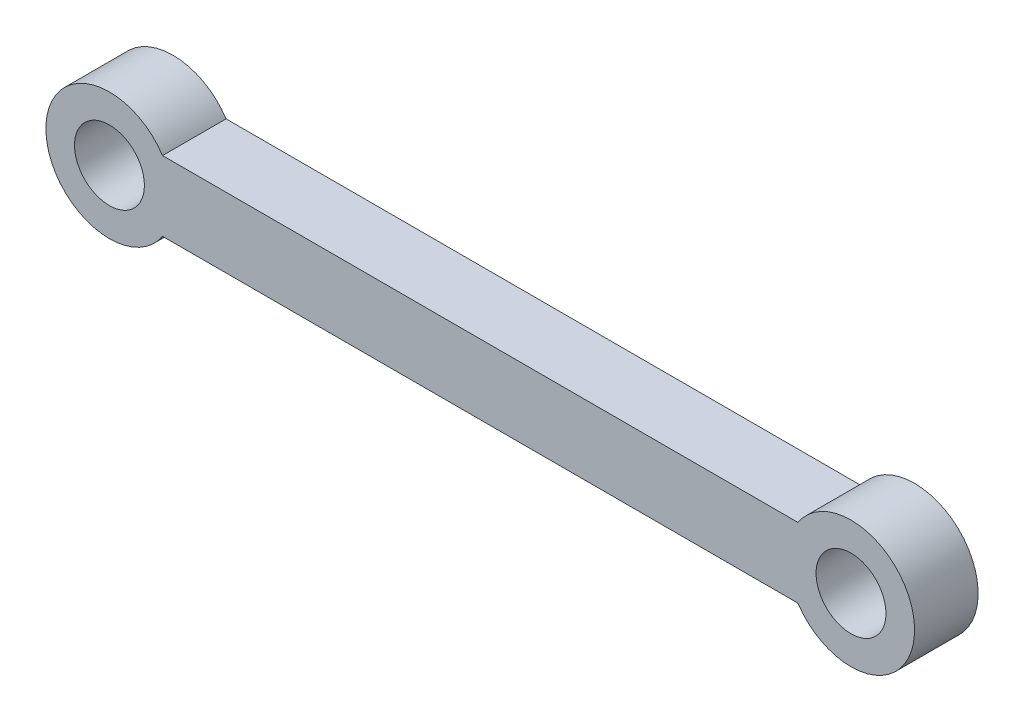
from build123d import *

# Parameters (mm, degrees)
EXTRUDE_1_DEPTH = 3


with BuildPart() as part:
    # 草图1 → 凸台-拉伸1 (new body)
    with BuildSketch(Plane.XY):
        with BuildLine():
            Line((32.494506037, 1.65), (2.505493963, 1.65))
            ThreePointArc((2.505493963, 1.65), (2.87371553, 0.86125435), (3, 0))
            ThreePointArc((3, 0), (2.87371553, -0.86125435), (2.505493963, -1.65))
            Line((2.505493963, -1.65), (32.494506037, -1.65))
            ThreePointArc((32.494506037, -1.65), (32, 0), (32.494506037, 1.65))
        make_face()
        with BuildLine():
            ThreePointArc((0, -1.65), (-1.65, 0), (0, 1.65))
            Line((0, 1.65), (2.505493963, 1.65))
            ThreePointArc((2.505493963, 1.65), (-3, 0), (2.505493963, -1.65))
            Line((2.505493963, -1.65), (0, -1.65))
        make_face()
        with BuildLine():
            Line((2.505493963, 1.65), (0, 1.65))
            ThreePointArc((0, 1.65), (1.166726189, 1.166726189), (1.65, 0))
            ThreePointArc((1.65, 0), (1.166726189, -1.166726189), (0, -1.65))
            Line((0, -1.65), (2.505493963, -1.65))
            ThreePointArc((2.505493963, -1.65), (2.87371553, -0.86125435), (3, 0))
            ThreePointArc((3, 0), (2.87371553, 0.86125435), (2.505493963, 1.65))
        make_face()
        with BuildLine():
            ThreePointArc((38, 0), (35.86125435, 2.87371553), (32.494506037, 1.65))
            Line((32.494506037, 1.65), (35, 1.65))
            ThreePointArc((35, 1.65), (36.166726189, 1.166726189), (36.65, 0))
            ThreePointArc((36.65, 0), (36.166726189, -1.166726189), (35, -1.65))
            Line((35, -1.65), (32.494506037, -1.65))
            ThreePointArc((32.494506037, -1.65), (35.86125435, -2.87371553), (38, 0))
        make_face()
        with BuildLine():
            Line((35, 1.65), (32.494506037, 1.65))
            ThreePointArc((32.494506037, 1.65), (32, 0), (32.494506037, -1.65))
            Line((32.494506037, -1.65), (35, -1.65))
            ThreePointArc((35, -1.65), (33.35, 0), (35, 1.65))
        make_face()
    extrude(amount=EXTRUDE_1_DEPTH)


solid = part.part
